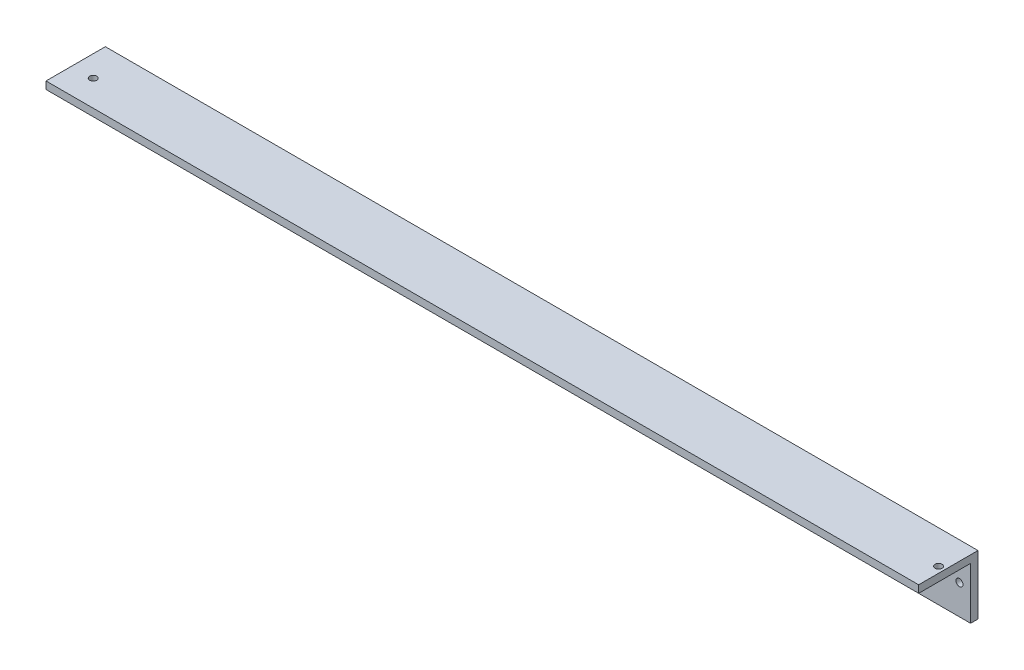
from build123d import *

# Parameters (mm, degrees)
CROQUIS1_W              = 1206.08
CROQUIS1_H              = 80
CROQUIS1_R              = 4.7625
CROQUIS1_R_2            = 4.765
SALIENTE_EXTRUIR1_DEPTH = 10
CROQUIS2_W              = 1206.08
CROQUIS2_H              = 10
SALIENTE_EXTRUIR2_DEPTH = 70
CROQUIS3_R              = 4.765
CORTAR_EXTRUIR1_DEPTH   = 1211.755535358
CORTAR_EXTRUIR2_DEPTH   = 15
CORTAR_EXTRUIR3_DEPTH   = 15


with BuildPart() as part:
    # Croquis1 → Saliente-Extruir1 (new body)
    with BuildSketch(Plane.XY):
        with Locations((603.04, 40)):
            Rectangle(CROQUIS1_W, CROQUIS1_H)
        with Locations((30, 40)):
            Circle(CROQUIS1_R, mode=Mode.SUBTRACT)
        with Locations((1176.08, 40)):
            Circle(CROQUIS1_R_2, mode=Mode.SUBTRACT)
    extrude(amount=SALIENTE_EXTRUIR1_DEPTH)

    # Croquis2 → Saliente-Extruir2 (add)
    with BuildSketch(Plane.XY.offset(10)):
        with Locations((603.04, 75)):
            Rectangle(CROQUIS2_W, CROQUIS2_H)
    extrude(amount=SALIENTE_EXTRUIR2_DEPTH)

    # Croquis3 → Cortar-Extruir1 (cut, through all)
    with BuildSketch(Plane.XZ.offset(-70)):
        with Locations((1182.956834807, 45)):
            Circle(CROQUIS3_R)
        with Locations((43.661184758, 45)):
            Circle(CROQUIS3_R)
    extrude(amount=-CORTAR_EXTRUIR1_DEPTH, mode=Mode.SUBTRACT)

    # Croquis4 → Cortar-Extruir2 (cut)
    with BuildSketch(Plane(origin=(1206.08, 0, 0), x_dir=(0, 0, -1), z_dir=(1, 0, 0))):
        Polygon((-10, 0), (0, 0), (0, 80), (-80, 80), (-80, 70), (-10, 70), align=None)
    extrude(amount=-CORTAR_EXTRUIR2_DEPTH, mode=Mode.SUBTRACT)

    # Croquis5 → Cortar-Extruir3 (cut)
    with BuildSketch(Plane.ZY):
        Polygon((0, 80), (0, 0), (10, 0), (10, 70), (80, 70), (80, 80), align=None)
    extrude(amount=-CORTAR_EXTRUIR3_DEPTH, mode=Mode.SUBTRACT)


solid = part.part
